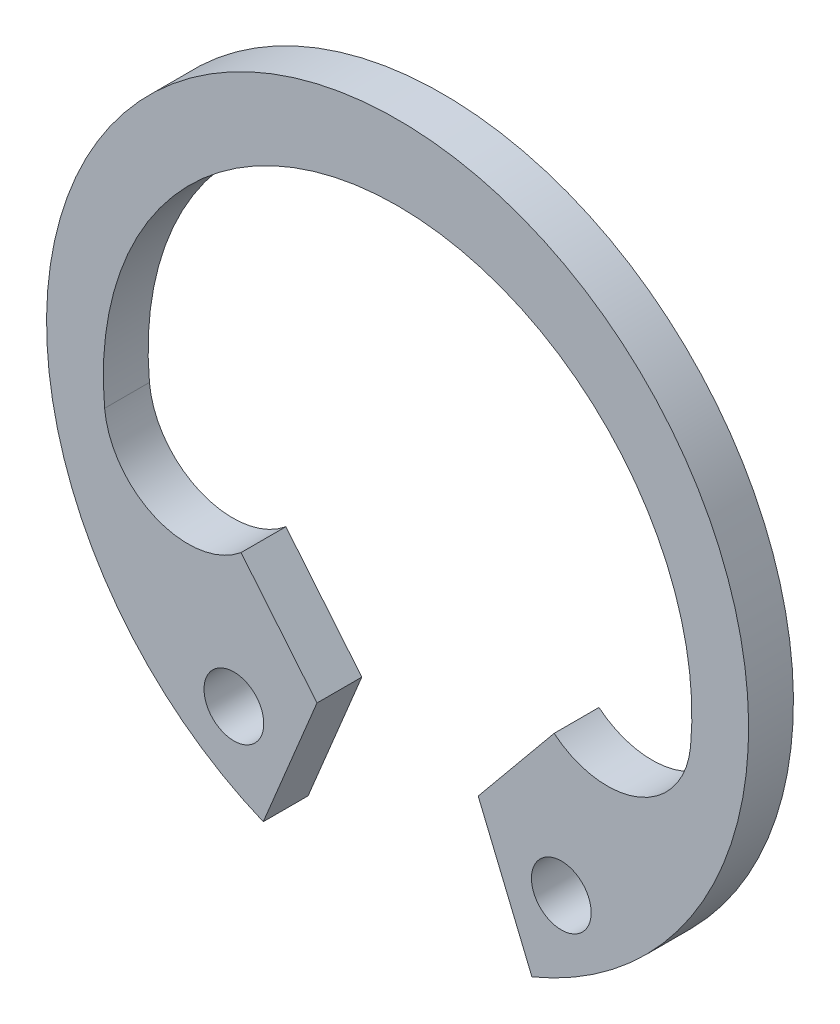
from build123d import *

# Parameters (mm, degrees)
SKETCH_1_R        = 1
EXTRUDE_831_DEPTH = 1.5


with BuildPart() as part:
    # 草图1 → Extrude 831 (new body)
    with BuildSketch(Plane.XY):
        with BuildLine():
            Line((-5.239607816, -3.42469179), (-2.697918198, -6.513350704))
            Line((-2.697918198, -6.513350704), (-4.49653033, -10.855584507))
            ThreePointArc((-4.49653033, -10.855584507), (0, 11.75), (4.49653033, -10.855584507))
            Line((4.49653033, -10.855584507), (2.697918198, -6.513350704))
            Line((2.697918198, -6.513350704), (5.239607816, -3.42469179))
            ThreePointArc((5.239607816, -3.42469179), (8.093813076, -3.84803701), (9.806395304, -1.525802967))
            ThreePointArc((9.806395304, -1.525802967), (0, 9.25), (-9.806395304, -1.525802967))
            ThreePointArc((-9.806395304, -1.525802967), (-8.093813076, -3.84803701), (-5.239607816, -3.42469179))
        make_face()
        with Locations((-5.480027646, -8.003705205)):
            Circle(SKETCH_1_R, mode=Mode.SUBTRACT)
        with Locations(Location((5.480027646, -8.003705205, 0), (0, 0, 180))):
            Circle(SKETCH_1_R, mode=Mode.SUBTRACT)
    extrude(amount=EXTRUDE_831_DEPTH)


solid = part.part
